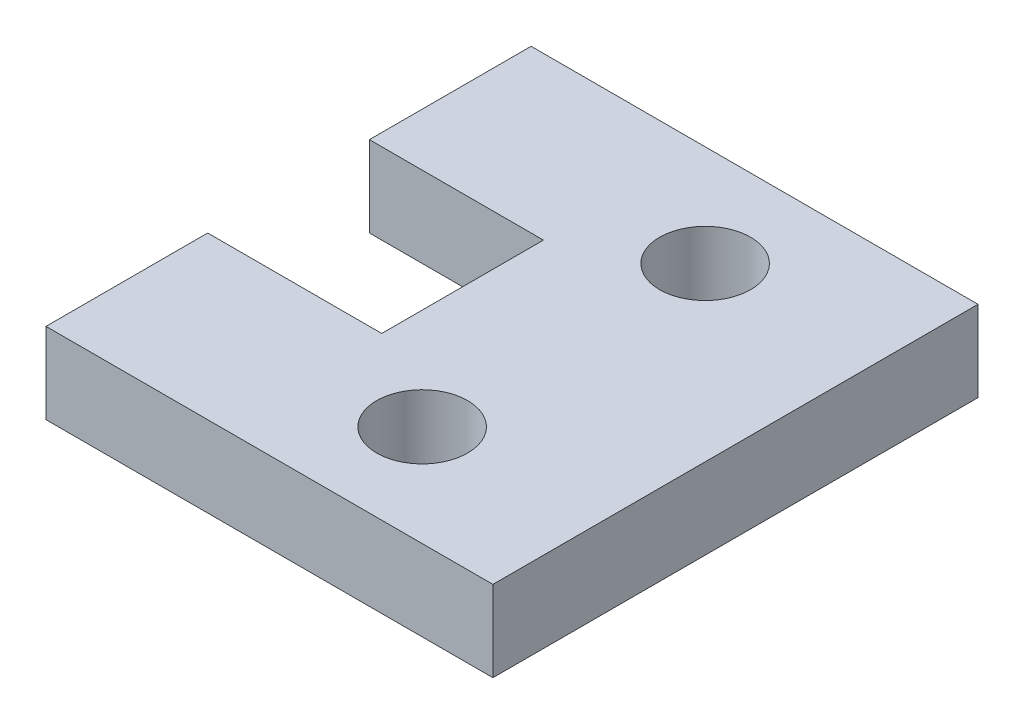
from build123d import *

# Parameters (mm, degrees)
SKETCH1_3_R         = 2.25
BOSS_EXTRUDE2_DEPTH = 4


with BuildPart() as part:
    # Sketch1<3> → Boss-Extrude2 (new body)
    with BuildSketch(Plane(origin=(0, 0, 0), x_dir=(1, 0, 0), z_dir=(0, 1, 0))):
        Polygon((-13.60994599, -4), (-13.60994599, -12), (8.5, -12), (8.5, 12), (-13.60994599, 12), (-13.60994599, 4), (-5, 4), (-5, -4), align=None)
        with Locations((0, -7)):
            Circle(SKETCH1_3_R, mode=Mode.SUBTRACT)
        with Locations((0, 7)):
            Circle(SKETCH1_3_R, mode=Mode.SUBTRACT)
    extrude(amount=BOSS_EXTRUDE2_DEPTH)


solid = part.part
